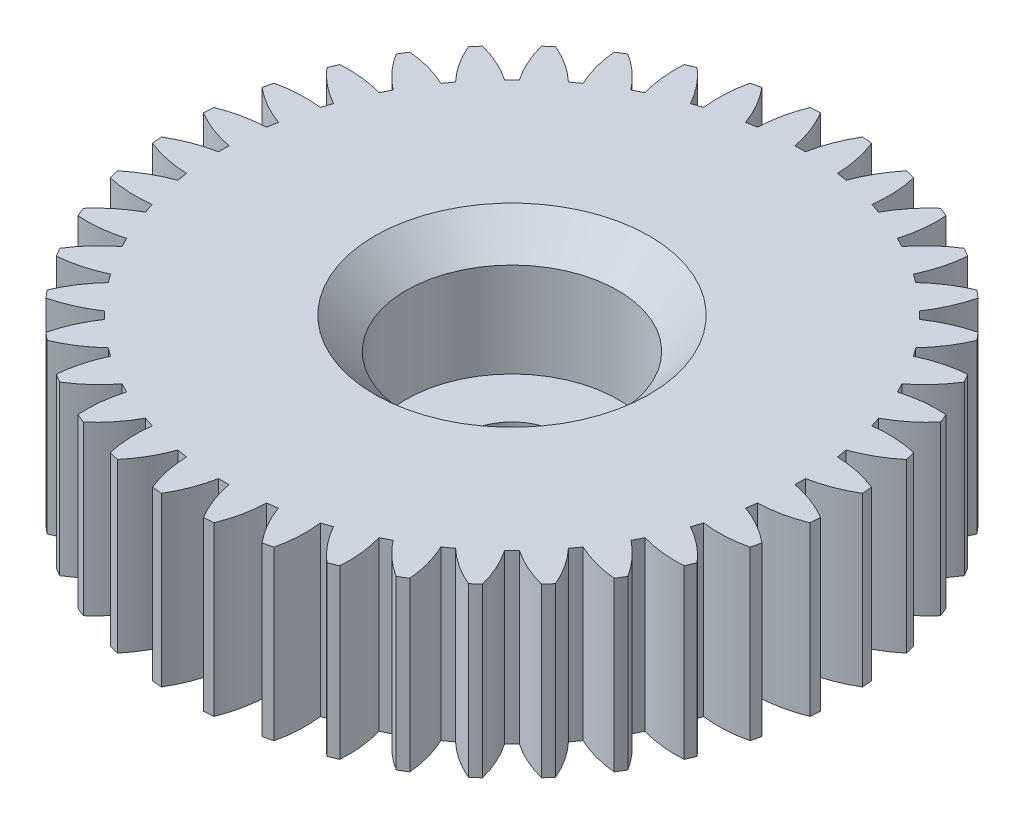
from build123d import *

# Parameters (mm, degrees)
SKETCH1_R           = 2.525
SKETCH1_R_2         = 1.125
BOSS_EXTRUDE1_DEPTH = 1
SKETCH1_3_R         = 7.875
SKETCH1_3_R_2       = 2.525
BOSS_EXTRUDE2_DEPTH = 4
CUT_EXTRUDE1_DEPTH  = 12.833480046
CIRPATTERN3_COUNT   = 40
CHAMFER1_SIZE       = 0.75


with BuildPart() as part:
    # Sketch1 → Boss-Extrude1 (new body)
    with BuildSketch(Plane(origin=(0, 0, 0), x_dir=(1, 0, 0), z_dir=(0, 1, 0))):
        Circle(SKETCH1_R)
        Circle(SKETCH1_R_2, mode=Mode.SUBTRACT)
    extrude(amount=BOSS_EXTRUDE1_DEPTH)

    # Sketch1<3> → Boss-Extrude2 (add)
    with BuildSketch(Plane(origin=(0, 0, 0), x_dir=(1, 0, 0), z_dir=(0, 1, 0))):
        Circle(SKETCH1_3_R)
        Circle(SKETCH1_3_R_2, mode=Mode.SUBTRACT)
    extrude(amount=BOSS_EXTRUDE2_DEPTH)

    # Sketch1<5> → Cut-Extrude1 (cut, through all)
    with BuildSketch(Plane(origin=(0, 0, 0), x_dir=(1, 0, 0), z_dir=(0, 1, 0))):
        with BuildLine():
            ThreePointArc((0.125, 6.873863542), (0.268883758, 7.383088247), (0.5, 7.859110955))
            ThreePointArc((0.5, 7.859110955), (0, 7.875), (-0.5, 7.859110955))
            ThreePointArc((-0.5, 7.859110955), (-0.268883758, 7.383088247), (-0.125, 6.873863542))
            ThreePointArc((-0.125, 6.873863542), (0, 6.875), (0.125, 6.873863542))
        make_face()
    cut_extrude1 = extrude(amount=CUT_EXTRUDE1_DEPTH, mode=Mode.SUBTRACT)

    # CirPattern3: Cut-Extrude1 ×40 about axis
    cirpattern3_axis = Axis((0, 4, 0), (0, -1, 0))
    for i in range(1, CIRPATTERN3_COUNT):
        add(cut_extrude1.rotate(cirpattern3_axis, i * 360 / CIRPATTERN3_COUNT), mode=Mode.SUBTRACT)

    # Chamfer1
    chamfer1_edges = [part.edges().sort_by_distance(p)[0] for p in [
        (-2.525, 4, 0),
    ]]
    chamfer(chamfer1_edges, length=CHAMFER1_SIZE)


solid = part.part
